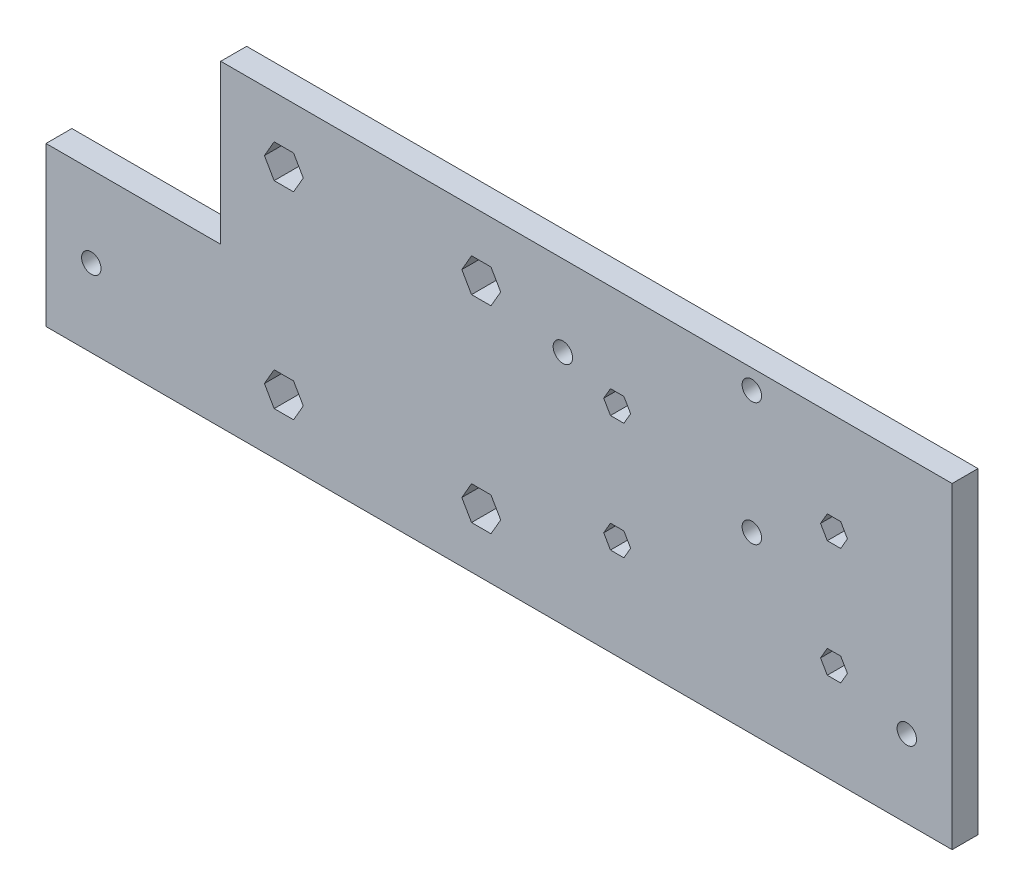
from build123d import *

# Parameters (mm, degrees)
BOSS_EXTRUDE1_DEPTH = 4
SKETCH2_R           = 1.5
CUT_EXTRUDE1_DEPTH  = 4
CUT_EXTRUDE5_DEPTH  = 34
CUT_EXTRUDE6_DEPTH  = 34
SKETCH6_R           = 1.5
CUT_EXTRUDE7_DEPTH  = 10


with BuildPart() as part:
    # Sketch1 → Boss-Extrude1 (new body)
    with BuildSketch(Plane.XY):
        Polygon((0, 0), (-40, 0), (-40, 24.5), (-13, 24.5), (-13, 49), (100, 49), (100, 0), align=None)
    extrude(amount=BOSS_EXTRUDE1_DEPTH)

    # Sketch2 → Cut-Extrude1 (cut)
    with BuildSketch(Plane.XY.offset(4)):
        with Locations((39.857429038, 36.5)):
            Circle(SKETCH2_R)
        with Locations((69.057429038, 27)):
            Circle(SKETCH2_R)
        with Locations((69.057429038, 46)):
            Circle(SKETCH2_R)
    extrude(amount=-CUT_EXTRUDE1_DEPTH, mode=Mode.SUBTRACT)

    # Sketch4 → Cut-Extrude5 (cut)
    with BuildSketch(Plane(origin=(0, 0, -4), x_dir=(-1, 0, 0), z_dir=(0, 0, -1))):
        Polygon((-80.710769515, 31.7), (-79.671539031, 33.5), (-80.710769515, 35.3), (-82.789230485, 35.3), (-83.828460969, 33.5), (-82.789230485, 31.7), align=None)
        Polygon((-47.210769515, 31.7), (-46.171539031, 33.5), (-47.210769515, 35.3), (-49.289230485, 35.3), (-50.328460969, 33.5), (-49.289230485, 31.7), align=None)
        Polygon((-47.210769515, 13.7), (-46.171539031, 15.5), (-47.210769515, 17.3), (-49.289230485, 17.3), (-50.328460969, 15.5), (-49.289230485, 13.7), align=None)
        Polygon((-80.710769515, 13.7), (-79.671539031, 15.5), (-80.710769515, 17.3), (-82.789230485, 17.3), (-83.828460969, 15.5), (-82.789230485, 13.7), align=None)
    extrude(amount=-CUT_EXTRUDE5_DEPTH, mode=Mode.SUBTRACT)

    # Sketch5 → Cut-Extrude6 (cut)
    with BuildSketch(Plane(origin=(0, 0, 0), x_dir=(-1, 0, 0), z_dir=(0, 0, -1))):
        Polygon((4.7511107, 37.15), (6.2522214, 39.75), (4.7511107, 42.35), (1.7488893, 42.35), (0.2477786, 39.75), (1.7488893, 37.15), align=None)
        Polygon((-25.7488893, 37.15), (-24.2477786, 39.75), (-25.7488893, 42.35), (-28.7511107, 42.35), (-30.2522214, 39.75), (-28.7511107, 37.15), align=None)
        Polygon((-25.7488893, 6.65), (-24.2477786, 9.25), (-25.7488893, 11.85), (-28.7511107, 11.85), (-30.2522214, 9.25), (-28.7511107, 6.65), align=None)
        Polygon((4.7511107, 6.65), (6.2522214, 9.25), (4.7511107, 11.85), (1.7488893, 11.85), (0.2477786, 9.25), (1.7488893, 6.65), align=None)
    extrude(amount=-CUT_EXTRUDE6_DEPTH, mode=Mode.SUBTRACT)

    # Sketch6 → Cut-Extrude7 (cut)
    with BuildSketch(Plane.XY.offset(4)):
        with Locations((-33, 12)):
            Circle(SKETCH6_R)
        with Locations((93, 12)):
            Circle(SKETCH6_R)
    extrude(amount=-CUT_EXTRUDE7_DEPTH, mode=Mode.SUBTRACT)


solid = part.part
